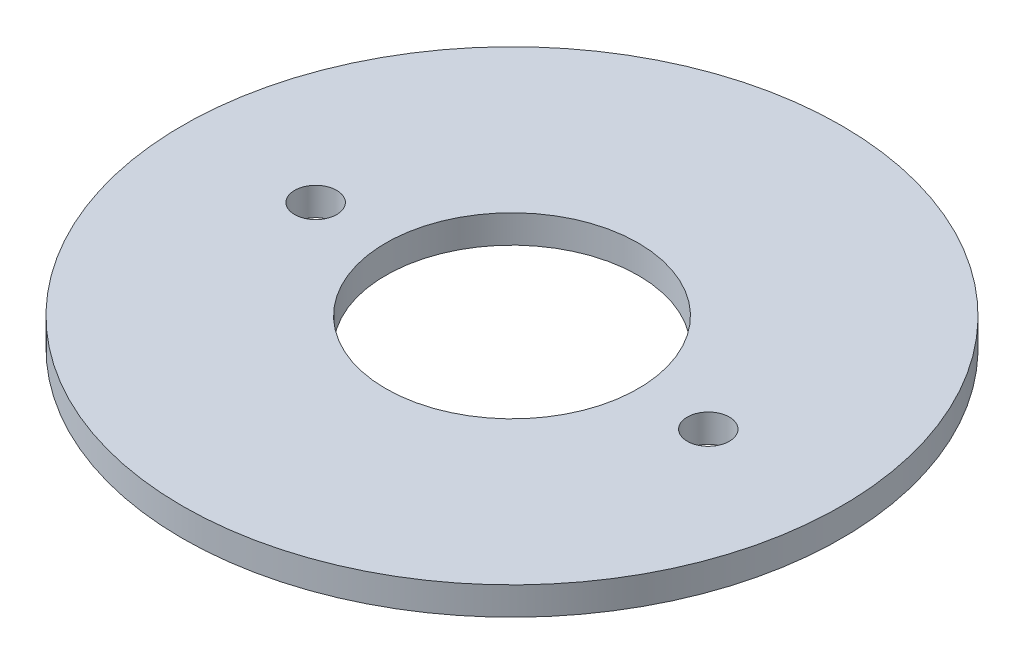
from build123d import *

# Parameters (mm, degrees)
SKETCH2_R           = 23.5
SKETCH2_R_2         = 9
SKETCH2_R_3         = 1.5
BOSS_EXTRUDE1_DEPTH = 2


with BuildPart() as part:
    # Sketch2 → Boss-Extrude1 (new body)
    with BuildSketch(Plane(origin=(0, 0, 0), x_dir=(1, 0, 0), z_dir=(0, 1, 0))):
        with Locations(Location((0, 0, 0), (0, 0, 270))):
            Circle(SKETCH2_R)
        with Locations(Location((0, 0, 0), (0, 0, 270))):
            Circle(SKETCH2_R_2, mode=Mode.SUBTRACT)
        with Locations(Location((-14, 0, 0), (0, 0, 270))):
            Circle(SKETCH2_R_3, mode=Mode.SUBTRACT)
        with Locations(Location((14, 0, 0), (0, 0, 90))):
            Circle(SKETCH2_R_3, mode=Mode.SUBTRACT)
    extrude(amount=BOSS_EXTRUDE1_DEPTH)


solid = part.part
